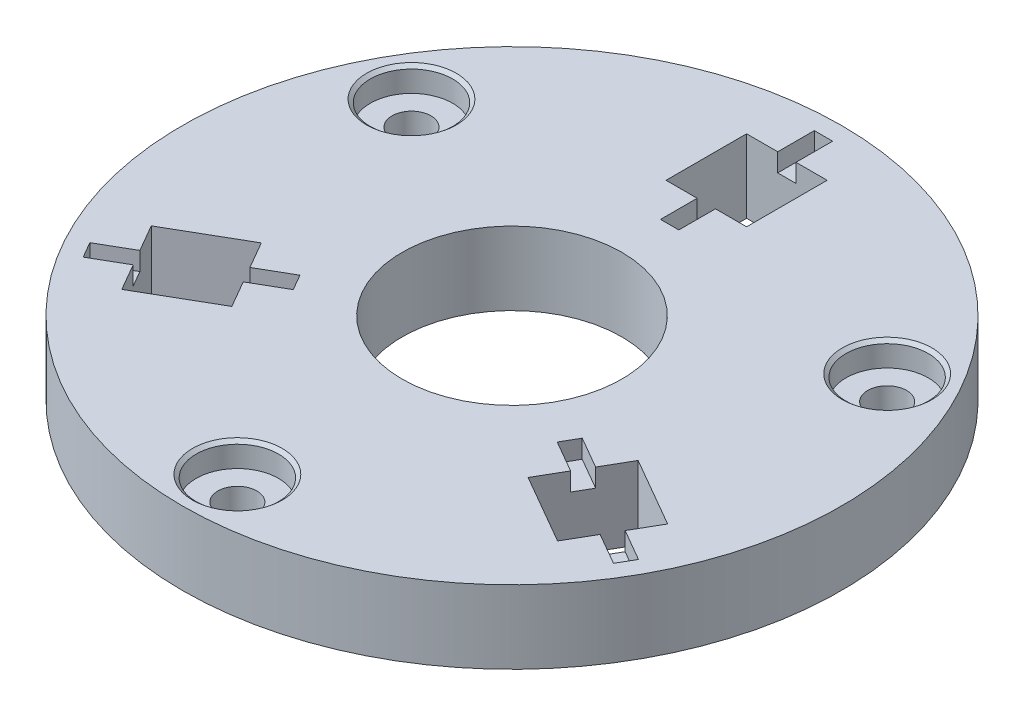
from build123d import *

# Parameters (mm, degrees)
SKETCH1_R                                    = 57.15
BOSS_EXTRUDE1_DEPTH                          = 12.7
SKETCH2_R                                    = 19.05
CUT_EXTRUDE1_DEPTH                           = 76.2
CBORE_FOR_1_4_BINDING_HEAD_MACHINE_S_2_COUNT = 2
CBORE_FOR_1_4_BINDING_HEAD_MACHINE_S_2_PITCH = 82.48891971
CBORE_FOR_1_4_BINDING_HEAD_MACHINE_S_3_COUNT = 2
CBORE_FOR_1_4_BINDING_HEAD_MACHINE_S_3_PITCH = 82.48891971
SKETCH5_W                                    = 13.97
SKETCH5_H                                    = 13.97
CUT_EXTRUDE2_DEPTH                           = 12.7
SKETCH7_W                                    = 3.175
SKETCH7_H                                    = 6.35
CUT_EXTRUDE4_DEPTH                           = 3.175


with BuildPart() as part:
    # Sketch1 → Boss-Extrude1 (new body)
    with BuildSketch(Plane(origin=(0, 0, 0), x_dir=(1, 0, 0), z_dir=(0, 1, 0))):
        with Locations(Location((0, 0, 0), (0, 0, 270))):
            Circle(SKETCH1_R)
    extrude(amount=BOSS_EXTRUDE1_DEPTH)

    # Sketch2 → Cut-Extrude1 (cut)
    with BuildSketch(Plane(origin=(0, 12.7, 0), x_dir=(1, 0, 0), z_dir=(0, 1, 0))):
        with Locations(Location((0, 0, 0), (0, 0, 270))):
            Circle(SKETCH2_R)
    extrude(amount=-CUT_EXTRUDE1_DEPTH, mode=Mode.SUBTRACT)

    # Sketch4 → CBORE for 1/4 Binding Head Machine Screw1 (revolve, cut)
    with BuildSketch(Plane(origin=(-41.244459855, 12.7, -23.8125), x_dir=(0, 0, 1), z_dir=(1, 0, 0))):
        Polygon((0, 0), (0, 12.7), (3.3782, 12.7), (3.3782, 4.191), (7.14375, 4.191), (7.14375, 0.532828266), (7.77875, 0), align=None)
    cbore_for_1_4_binding_head_machine_screw = revolve(axis=Axis((-41.244459855, 19.05, -23.8125), (0, -1, 0)), mode=Mode.SUBTRACT)

    # CBORE for 1_4 Binding Head Machine S 2: CBORE for 1/4 Binding Head Machine Screw1 ×2
    with Locations(*[(i * CBORE_FOR_1_4_BINDING_HEAD_MACHINE_S_2_PITCH, 0, 0) for i in range(1, CBORE_FOR_1_4_BINDING_HEAD_MACHINE_S_2_COUNT)]):
        add(cbore_for_1_4_binding_head_machine_screw, mode=Mode.SUBTRACT)

    # CBORE for 1_4 Binding Head Machine S 3: CBORE for 1/4 Binding Head Machine Screw1 ×2
    with Locations(*[Vector(0.4999999999999999, 0, 0.8660254037844388) * (i * CBORE_FOR_1_4_BINDING_HEAD_MACHINE_S_3_PITCH) for i in range(1, CBORE_FOR_1_4_BINDING_HEAD_MACHINE_S_3_COUNT)]):
        add(cbore_for_1_4_binding_head_machine_screw, mode=Mode.SUBTRACT)

    # Sketch5 → Cut-Extrude2 (cut)
    with BuildSketch(Plane(origin=(0, 12.7, 0), x_dir=(1, 0, 0), z_dir=(0, 1, 0))):
        Polygon((-44.771313472, -17.783146625), (-32.672938582, -10.798146625), (-25.687938582, -22.896521516), (-37.786313472, -29.881521516), align=None)
        Polygon((32.672938582, -10.798146625), (44.771313472, -17.783146625), (37.786313472, -29.881521516), (25.687938582, -22.896521516), align=None)
        with Locations((0, 40.67966814)):
            Rectangle(SKETCH5_W, SKETCH5_H)
    extrude(amount=-CUT_EXTRUDE2_DEPTH, mode=Mode.SUBTRACT)

    # Sketch7 → Cut-Extrude4 (cut)
    with BuildSketch(Plane(origin=(0, 12.7, 0), x_dir=(1, 0, 0), z_dir=(0, 1, 0))):
        with Locations((0, 50.83966814)):
            Rectangle(SKETCH7_W, SKETCH7_H)
        with Locations((0, 30.51966814)):
            Rectangle(SKETCH7_W, SKETCH7_H)
        Polygon((42.072563472, -22.457518742), (47.571824786, -25.632518742), (45.984324786, -28.382149399), (40.485063472, -25.207149399), align=None)
        Polygon((29.974188582, -15.472518742), (24.474927268, -12.297518742), (22.887427268, -15.047149399), (28.386688582, -18.222149399), align=None)
        Polygon((-40.485063472, -25.207149399), (-45.984324786, -28.382149399), (-47.571824786, -25.632518742), (-42.072563472, -22.457518742), align=None)
        Polygon((-28.386688582, -18.222149399), (-22.887427268, -15.047149399), (-24.474927268, -12.297518742), (-29.974188582, -15.472518742), align=None)
    extrude(amount=-CUT_EXTRUDE4_DEPTH, mode=Mode.SUBTRACT)


solid = part.part
